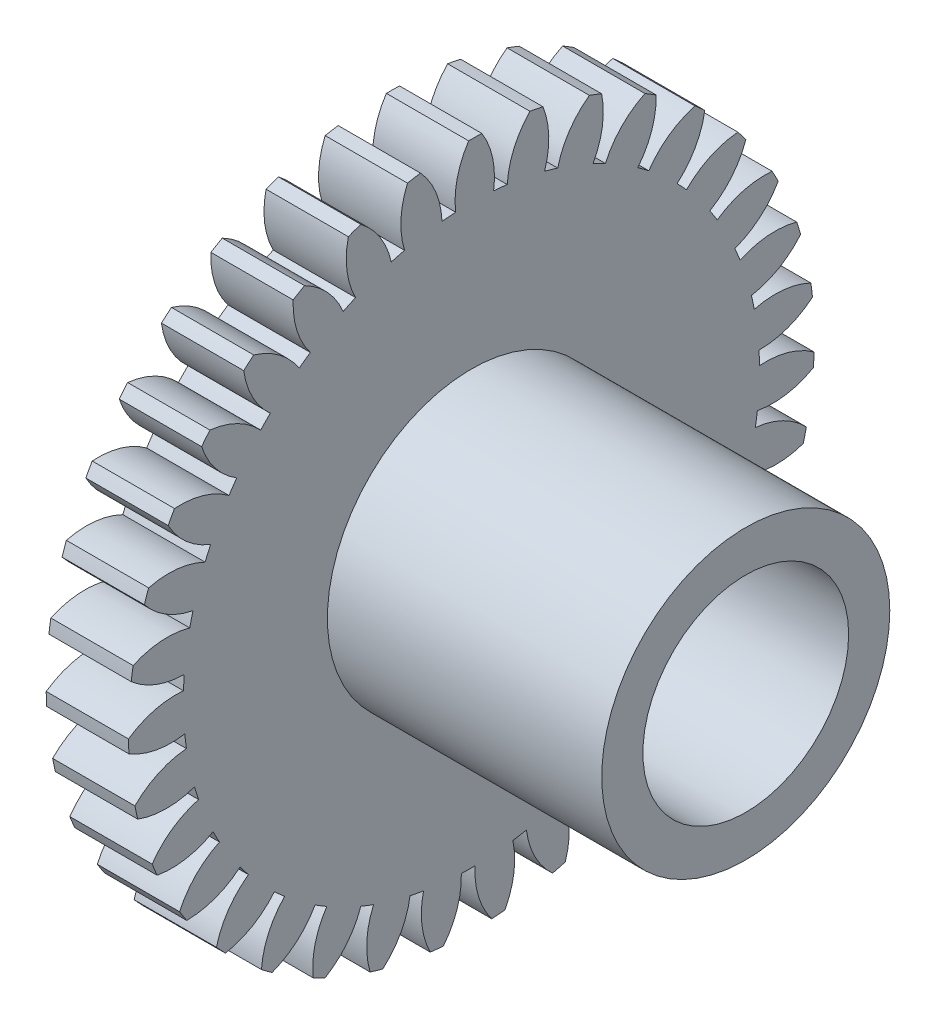
from build123d import *

# Parameters (mm, degrees)
CUT_EXTRUDE1_DEPTH = 22.943108257
CIRPATTERN1_COUNT  = 35


with BuildPart() as part:
    # Sketch1 → Revolve1 (revolve)
    with BuildSketch(Plane.XY, mode=Mode.PRIVATE) as revolve1_sk:
        Polygon((0, 3.75), (-13, 3.75), (-13, 12.5), (-10, 12.5), (-10, 5.25), (0, 5.25), align=None)
    revolve(revolve1_sk.sketch.rotate(Axis((0, 0, 0), (-1, 0, 0)), 90), axis=Axis((0, 0, 0), (-1, 0, 0)))

    # Sketch2 → Cut-Extrude1 (cut, through all)
    with BuildSketch(Plane.ZY.offset(13)):
        with BuildLine():
            ThreePointArc((0.099998933, 12.499600002), (0.516553712, 11.534159045), (0.574381221, 10.484278049))
            ThreePointArc((0.574381221, 10.484278049), (0.823820505, 10.467632004), (1.072792793, 10.445052208))
            ThreePointArc((1.072792793, 10.445052208), (1.294145921, 11.472961211), (1.856600459, 12.361352464))
            ThreePointArc((1.856600459, 12.361352464), (0.980738697, 12.461466672), (0.099998933, 12.499600002))
        make_face()
    cut_extrude1 = extrude(amount=-CUT_EXTRUDE1_DEPTH, mode=Mode.SUBTRACT)

    # CirPattern1: Cut-Extrude1 ×35 about axis
    cirpattern1_axis = Axis((0, 0, 0), (1, 0, 0))
    for i in range(1, CIRPATTERN1_COUNT):
        add(cut_extrude1.rotate(cirpattern1_axis, i * 360 / CIRPATTERN1_COUNT), mode=Mode.SUBTRACT)


solid = part.part
